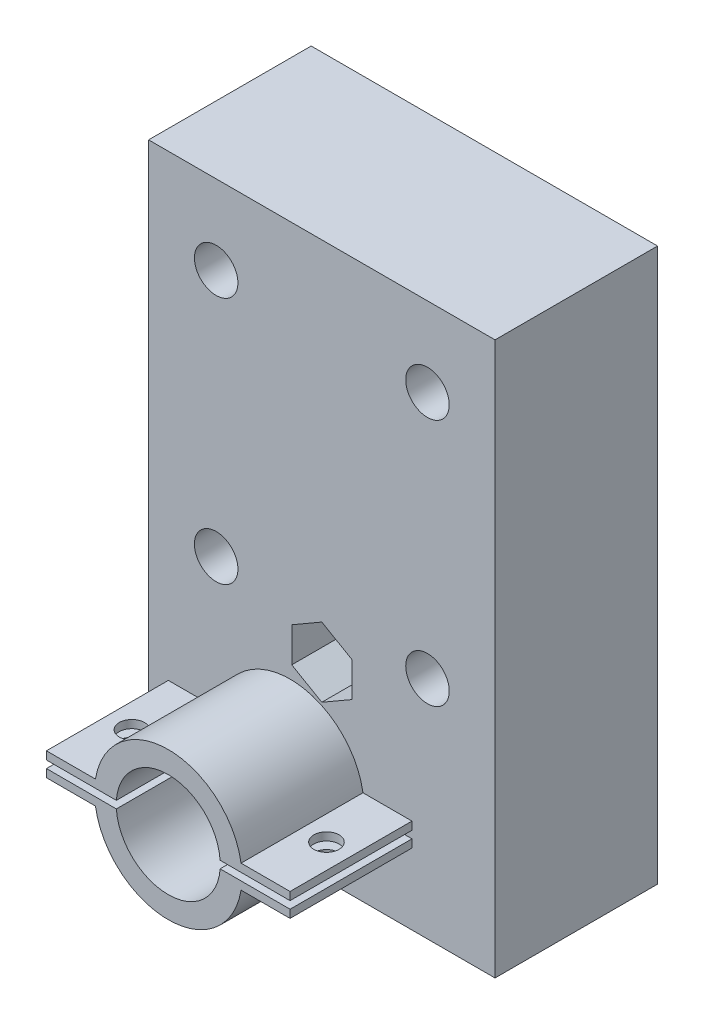
from build123d import *

# Parameters (mm, degrees)
SKETCH1_W           = 42.62295082
SKETCH1_H           = 50
SKETCH1_R           = 2.677018134
BOSS_EXTRUDE1_DEPTH = 20
SKETCH2_R           = 8.73
CUT_EXTRUDE2_DEPTH  = 7.94
SKETCH3_R           = 2.2
CUT_EXTRUDE3_DEPTH  = 10
CUT_EXTRUDE4_START  = -7
CUT_EXTRUDE4_DEPTH  = 32.460095998
SKETCH7_W           = 42.62295082
SKETCH7_H           = 20
BOSS_EXTRUDE2_DEPTH = 18
SKETCH6_R           = 6.4
CUT_EXTRUDE5_DEPTH  = 52.992105017
BOSS_EXTRUDE5_DEPTH = 15
SKETCH10_R          = 1.55
CUT_EXTRUDE8_DEPTH  = 80.392562524


with BuildPart() as part:
    # Sketch1 → Boss-Extrude1 (new body)
    with BuildSketch(Plane.XY):
        Rectangle(SKETCH1_W, SKETCH1_H)
        with Locations((-13, -15.25)):
            Circle(SKETCH1_R, mode=Mode.SUBTRACT)
        with Locations(Location((13, -15.25, 0), (0, 0, 180))):
            Circle(SKETCH1_R, mode=Mode.SUBTRACT)
        with Locations((13, 15.25)):
            Circle(SKETCH1_R, mode=Mode.SUBTRACT)
        with Locations(Location((-13, 15.25, 0), (0, 0, 180))):
            Circle(SKETCH1_R, mode=Mode.SUBTRACT)
    extrude(amount=BOSS_EXTRUDE1_DEPTH)

    # Sketch2 → Cut-Extrude2 (cut)
    with BuildSketch(Plane.XY):
        Circle(SKETCH2_R)
    extrude(amount=CUT_EXTRUDE2_DEPTH, mode=Mode.SUBTRACT)

    # Sketch3 → Cut-Extrude3 (cut)
    with BuildSketch(Plane(origin=(0, 0, 0), x_dir=(-1, 0, 0), z_dir=(0, 0, -1))):
        with Locations((0, -20)):
            Circle(SKETCH3_R)
    extrude(amount=-CUT_EXTRUDE3_DEPTH, mode=Mode.SUBTRACT)

    # Sketch5 → Cut-Extrude4 (cut, through all)
    with BuildSketch(Plane(origin=(0, 0, 0), x_dir=(-1, 0, 0), z_dir=(0, 0, -1)).offset(CUT_EXTRUDE4_START)):
        Polygon((0, -15.727608008), (-3.7, -17.863804004), (-3.7, -22.136195996), (0, -24.272391992), (3.7, -22.136195996), (3.7, -17.863804004), align=None)
    extrude(amount=-CUT_EXTRUDE4_DEPTH, mode=Mode.SUBTRACT)

    # Sketch7 → Boss-Extrude2 (add)
    with BuildSketch(Plane.XZ.offset(25)):
        with Locations((0, 10)):
            Rectangle(SKETCH7_W, SKETCH7_H)
    extrude(amount=BOSS_EXTRUDE2_DEPTH)

    # Sketch6 → Cut-Extrude5 (cut, through all)
    with BuildSketch(Plane(origin=(0, 0, 0), x_dir=(-1, 0, 0), z_dir=(0, 0, -1))):
        with Locations((3.896856088, -32.824049036)):
            Circle(SKETCH6_R)
    extrude(amount=-CUT_EXTRUDE5_DEPTH, mode=Mode.SUBTRACT)

    # Sketch8 → Boss-Extrude5 (add)
    with BuildSketch(Plane.XY.offset(20)):
        with BuildLine():
            ThreePointArc((-10.280677785, -32.369273769), (-3.896856088, -26.424049036), (2.486965609, -32.369273769))
            Line((2.486965609, -32.369273769), (11.091790538, -32.369273769))
            Line((11.091790538, -32.369273769), (11.091790538, -31.387593744))
            Line((11.091790538, -31.387593744), (5.061469986, -31.387593744))
            ThreePointArc((5.061469986, -31.387593744), (-3.896856088, -23.751287061), (-12.855182162, -31.387593744))
            Line((-12.855182162, -31.387593744), (-18.885502714, -31.387593744))
            Line((-18.885502714, -31.387593744), (-18.885502714, -32.369273769))
            Line((-18.885502714, -32.369273769), (-10.280677785, -32.369273769))
        make_face()
        with BuildLine():
            Line((-10.280677785, -33.278824303), (-18.885502714, -33.278824303))
            Line((-18.885502714, -33.278824303), (-18.885502714, -34.260504328))
            Line((-18.885502714, -34.260504328), (-12.855182162, -34.260504328))
            ThreePointArc((-12.855182162, -34.260504328), (-3.896856088, -41.896811011), (5.061469986, -34.260504328))
            Line((5.061469986, -34.260504328), (11.091790538, -34.260504328))
            Line((11.091790538, -34.260504328), (11.091790538, -33.278824303))
            Line((11.091790538, -33.278824303), (2.486965609, -33.278824303))
            ThreePointArc((2.486965609, -33.278824303), (-3.896856088, -39.224049036), (-10.280677785, -33.278824303))
        make_face()
    extrude(amount=BOSS_EXTRUDE5_DEPTH)

    # Sketch10 → Cut-Extrude8 (cut, through all)
    with BuildSketch(Plane.XZ.offset(43)):
        with Locations(Location((-15.870502714, 27.5, 0), (0, 0, 90))):
            Circle(SKETCH10_R)
        with Locations(Location((8.071790538, 27.5, 0), (0, 0, 270))):
            Circle(SKETCH10_R)
    extrude(amount=-CUT_EXTRUDE8_DEPTH, mode=Mode.SUBTRACT)


solid = part.part
